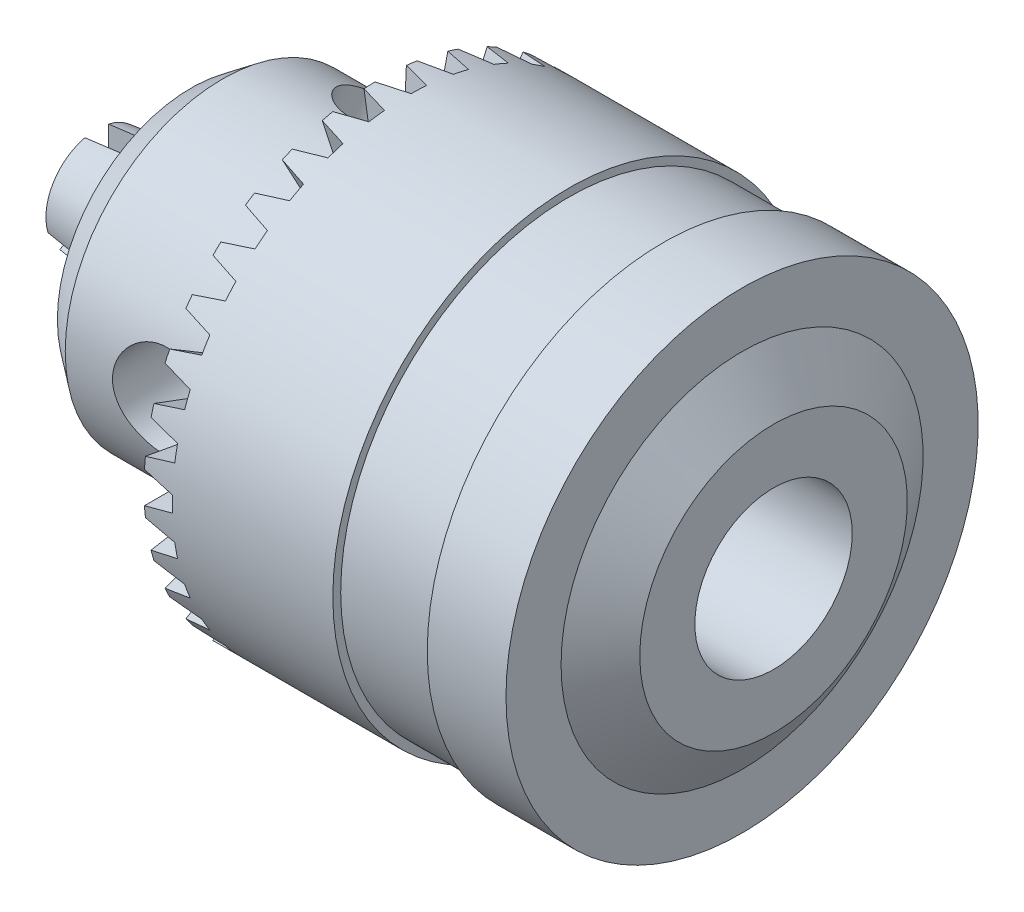
from build123d import *

# Parameters (mm, degrees)
SKETCH2_R               = 5
CUT_EXTRUDE1_DEPTH      = 16.7
CUT_EXTRUDE2_REACH      = 44.65
SKETCH3_R               = 4
SKETCH4_R               = 3
CUT_EXTRUDE3_DEPTH      = 4.65
CIRPATTERN1_COUNT       = 3
CUT_EXTRUDE4_REACH      = 36.529
CUT_EXTRUDE4_END_RADIUS = 15
CIRPATTERN2_COUNT       = 35
BOSS_EXTRUDE1_DEPTH     = 6
CUT_EXTRUDE5_REACH      = 44.65


with BuildPart() as part:
    # Sketch1 → Revolve1 (revolve)
    with BuildSketch(Plane.XY, mode=Mode.PRIVATE) as revolve1_sk:
        Polygon((-18.5, 0), (18.5, 0), (18.5, 8.5), (16.5, 11.5), (16.5, 15), (11.5, 15), (11.5, 14.5), (5.5, 14.5), (5.5, 15), (-6.5, 15), (-6.5, 10), (-16.5, 10), (-18.5, 8.5), align=None)
    revolve(revolve1_sk.sketch.rotate(Axis((-18.5, 0, 0), (1, 0, 0)), 90), axis=Axis((-18.5, 0, 0), (1, 0, 0)))

    # Sketch2 → Cut-Extrude1 (cut)
    with BuildSketch(Plane(origin=(18.5, 0, 0), x_dir=(0, 0, -1), z_dir=(1, 0, 0))):
        Circle(SKETCH2_R)
    extrude(amount=-CUT_EXTRUDE1_DEPTH, mode=Mode.SUBTRACT)

    # Sketch3 → Cut-Extrude2 (cut, up to next)
    with BuildSketch(Plane.ZY.offset(18.5), mode=Mode.PRIVATE) as cut_extrude2_sk1:
        Circle(SKETCH3_R)
    cut_extrude2_tool1 = extrude(cut_extrude2_sk1.sketch, amount=-CUT_EXTRUDE2_REACH, mode=Mode.PRIVATE) & part.part
    add(cut_extrude2_tool1.solids().sort_by_distance((-18.5, 0, 0))[0], mode=Mode.SUBTRACT)

    # Sketch4 → Cut-Extrude3 (cut)
    with BuildSketch(Plane.XY.offset(10)):
        with Locations((-10.5, 0)):
            Circle(SKETCH4_R)
    cut_extrude3 = extrude(amount=-CUT_EXTRUDE3_DEPTH, mode=Mode.SUBTRACT)

    # CirPattern1: Cut-Extrude3 ×3 about axis
    cirpattern1_axis = Axis((0, 0, 0), (1, 0, 0))
    for i in range(1, CIRPATTERN1_COUNT):
        add(cut_extrude3.rotate(cirpattern1_axis, i * 360 / CIRPATTERN1_COUNT), mode=Mode.SUBTRACT)

    # Cut-Extrude4: up to this cylinder (the profile starts inside it)
    cut_extrude4_end = Plane(origin=(-5.7, 0, 0), z_dir=(-1, 0, 0)) * Cylinder(CUT_EXTRUDE4_END_RADIUS, 104.058, mode=Mode.PRIVATE)
    # Sketch5 → Cut-Extrude4 (cut, up to the surface)
    with BuildSketch(Plane.XY.offset(10), mode=Mode.PRIVATE) as cut_extrude4_sk1:
        Polygon((-6.5, 1), (-4.7, 0.5), (-4.7, -0.5), (-6.5, -1), align=None)
    cut_extrude4_tool1 = extrude(cut_extrude4_sk1.sketch, amount=CUT_EXTRUDE4_REACH, mode=Mode.PRIVATE) & cut_extrude4_end
    cut_extrude4 = cut_extrude4_tool1.solids().sort_by_distance((-5.7, 0, 10))[0]
    add(cut_extrude4, mode=Mode.SUBTRACT)

    # CirPattern2: Cut-Extrude4 ×35 about axis
    cirpattern2_axis = Axis((0, 0, 0), (1, 0, 0))
    for i in range(1, CIRPATTERN2_COUNT):
        add(cut_extrude4.rotate(cirpattern2_axis, i * 360 / CIRPATTERN2_COUNT), mode=Mode.SUBTRACT)

    # Sketch6 → Boss-Extrude1 (add)
    with BuildSketch(Plane.ZY.offset(18.5)):
        with BuildLine():
            Line((0.75, 3.977400374), (0.75, 0.433012702))
            Line((0.75, 0.433012702), (3.819529765, -1.339181134))
            ThreePointArc((3.819529765, -1.339181134), (3.505233274, 2.023747374), (0.75, 3.977400374))
        make_face()
        with BuildLine():
            Line((-0.75, 3.977400374), (-0.75, 0.433012702))
            Line((-0.75, 0.433012702), (-3.819529765, -1.339181134))
            ThreePointArc((-3.819529765, -1.339181134), (-3.505233274, 2.023747374), (-0.75, 3.977400374))
        make_face()
        with BuildLine():
            Line((0, -0.866025404), (-3.069529765, -2.63821924))
            ThreePointArc((-3.069529765, -2.63821924), (0, -4.047494748), (3.069529765, -2.63821924))
            Line((3.069529765, -2.63821924), (0, -0.866025404))
        make_face()
    extrude(amount=BOSS_EXTRUDE1_DEPTH)

    # Sketch12 → Cut-Revolve3 (revolve, cut)
    with BuildSketch(Plane(origin=(0, 0, 0), x_dir=(1, 0, 0), z_dir=(0, 0.8660254037844398, -0.4999999999999982))):
        Polygon((-18.5, 4.377400374), (-24.5, 4.377400374), (-24.5, 3.227400374), (-18.5, 3.977400374), align=None)
    revolve(axis=Axis((-10.374418026, 0, 0), (-1, 0, 0)), mode=Mode.SUBTRACT)


with BuildPart() as cut_revolve3_piece_1:
    # of the separate pieces the step leaves, piece 1, a body of its own (cut_revolve3_pieces)
    add(part.part.solids().sort_by_distance((18.5, 0, 8.5))[0])



with BuildPart() as cut_revolve3_piece_2:
    # of the separate pieces the step leaves, piece 2, a body of its own (cut_revolve3_pieces)
    add(part.part.solids().sort_by_distance((-18.5, 3.906048353, -0.75))[0])


with BuildPart() as cut_revolve3_piece_3:
    # of the separate pieces the step leaves, piece 3, a body of its own (cut_revolve3_pieces)
    add(part.part.solids().sort_by_distance((-18.5, -1.303505124, 3.757737102))[0])


with BuildPart() as cut_revolve3_piece_4:
    # of the separate pieces the step leaves, piece 4, a body of its own (cut_revolve3_pieces)
    add(part.part.solids().sort_by_distance((-18.5, -0.866025404, 0))[0])


with BuildPart() as cut_revolve3_piece_1_1:
    add(cut_revolve3_piece_1.part)

    add(cut_revolve3_piece_2.part)  # Revolve2 merges Cut-Revolve3 piece 2

    add(cut_revolve3_piece_3.part)  # Revolve2 merges Cut-Revolve3 piece 3

    add(cut_revolve3_piece_4.part)  # Revolve2 merges Cut-Revolve3 piece 4
    # Sketch14 → Revolve2 (revolve)
    with BuildSketch(Plane(origin=(0, 0, 0), x_dir=(1, 0, 0), z_dir=(0, 0.8660254037844398, -0.4999999999999982)), mode=Mode.PRIVATE) as revolve2_sk:
        Polygon((-18.5, 0.433012702), (-13.45473427, 4), (-18.5, 4), align=None)
    revolve(revolve2_sk.sketch.rotate(Axis((-10.5, 0, 0), (-1, 0, 0)), 330), axis=Axis((-10.5, 0, 0), (-1, 0, 0)))

    # Sketch15 → Cut-Extrude5 (cut, up to next)
    with BuildSketch(Plane.ZY.offset(18.5), mode=Mode.PRIVATE) as cut_extrude5_sk1:
        Polygon((0.75, 3.906048353), (0.75, 0.433012702), (3.757737102, -1.303505124), (3.007737102, -2.602543229), (0, -0.866025404), (-3.007737102, -2.602543229), (-3.757737102, -1.303505124), (-0.75, 0.433012702), (-0.75, 3.906048353), align=None)
    cut_extrude5_tool1 = extrude(cut_extrude5_sk1.sketch, amount=-CUT_EXTRUDE5_REACH, mode=Mode.PRIVATE) & cut_revolve3_piece_1_1.part
    add(cut_extrude5_tool1.solids().sort_by_distance((-18.5, 0, 0))[0], mode=Mode.SUBTRACT)


solid = cut_revolve3_piece_1_1.part
